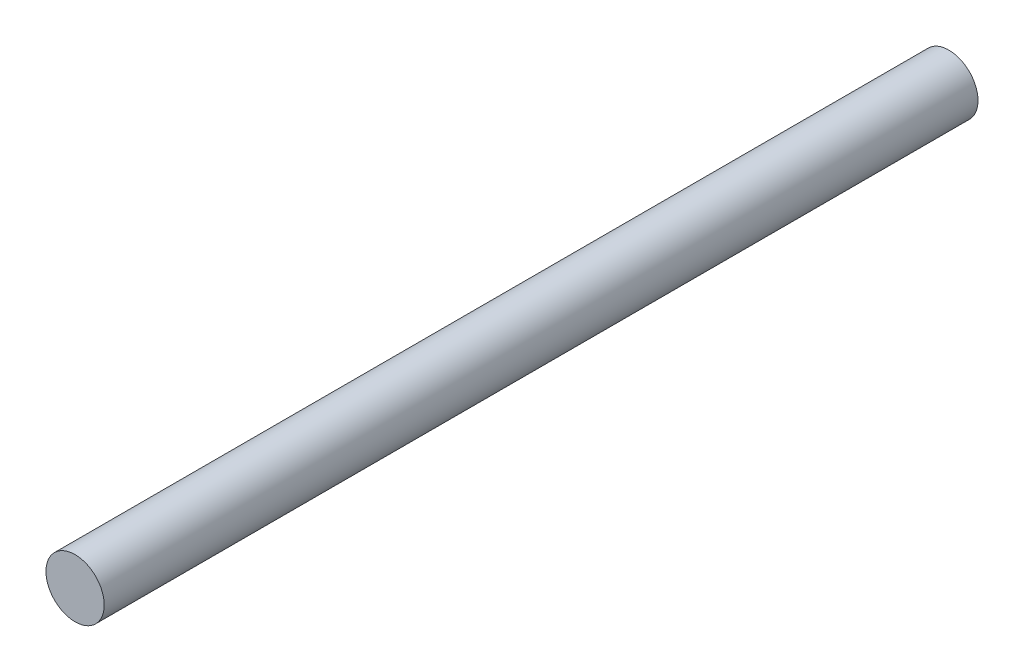
from build123d import *

# Parameters (mm, degrees)
ESQUISSE1_R        = 4
BOSS_EXTRU_1_DEPTH = 120


with BuildPart() as part:
    # Esquisse1 → Boss.-Extru.1 (new body)
    with BuildSketch(Plane.XY):
        Circle(ESQUISSE1_R)
    extrude(amount=BOSS_EXTRU_1_DEPTH)


solid = part.part
